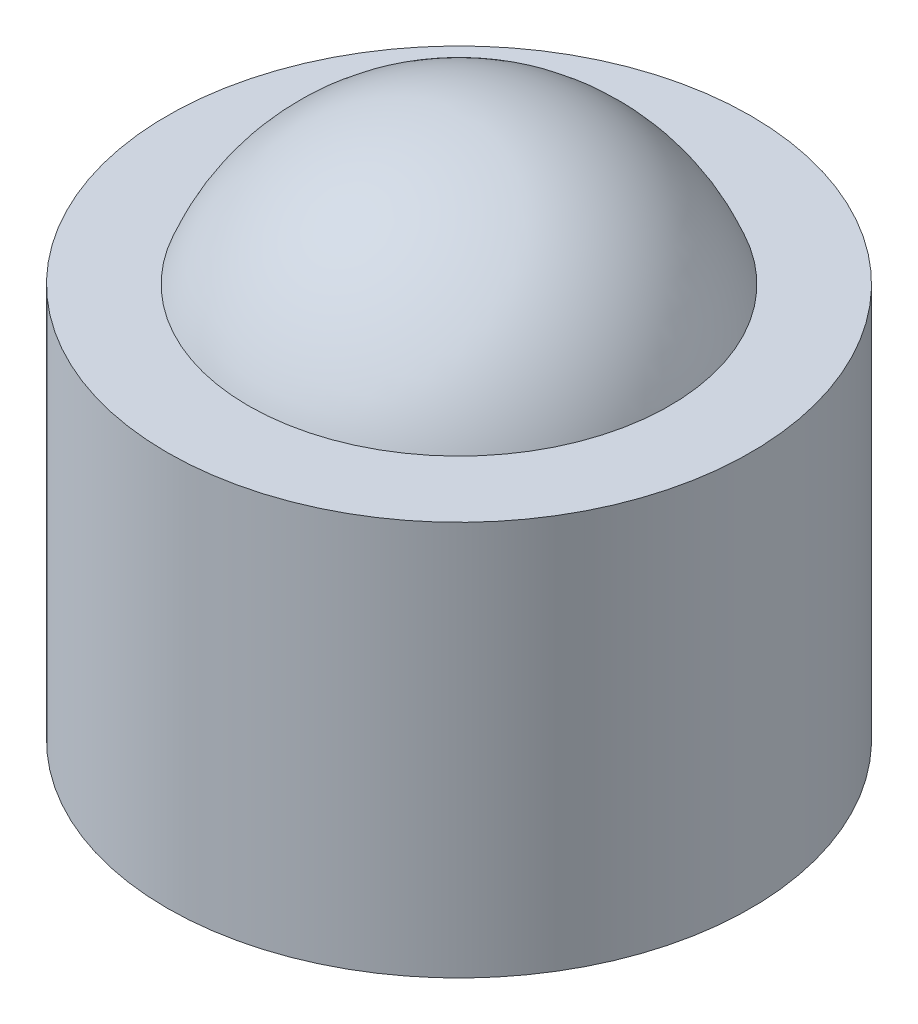
from build123d import *

# Parameters (mm, degrees)
SKETCH_2_W    = 5.6
SKETCH_2_H    = 7.57604586
SCALE_1_SCALE = 2.7
SCALE_2_SCALE = 0.72


with BuildPart() as part:
    # Sketch 1 → 旋转2 (revolve)
    with BuildSketch(Plane.XY):
        with BuildLine():
            Line((0, 4.32), (0, -4.32))
            ThreePointArc((0, -4.32), (4.32, 0), (0, 4.32))
        make_face()
    revolve(axis=Axis((0, 0, 0), (0, 1, 0)))

    # 草图2 → 旋转3 (revolve)
    with BuildSketch(Plane.XY, mode=Mode.PRIVATE) as revolve_3_sk:
        with Locations((2.8, -2.26802293)):
            Rectangle(SKETCH_2_W, SKETCH_2_H)
    revolve(revolve_3_sk.sketch.rotate(Axis((0, -6.05604586, 0), (0, 1, 0)), 180), axis=Axis((0, -6.05604586, 0), (0, 1, 0)))


with BuildPart() as part_1:
    # Масштаб1: scaled about (0, -1.786959448, 0)
    add(part.part.scale(SCALE_1_SCALE).moved(Location((0, 3.037831062, 0))))


with BuildPart() as part_2:
    # Масштаб2: scaled about (0, -1.786959449, 0)
    add(part_1.part.scale(SCALE_2_SCALE).moved(Location((0, -0.500348646, 0))))


solid = part_2.part
